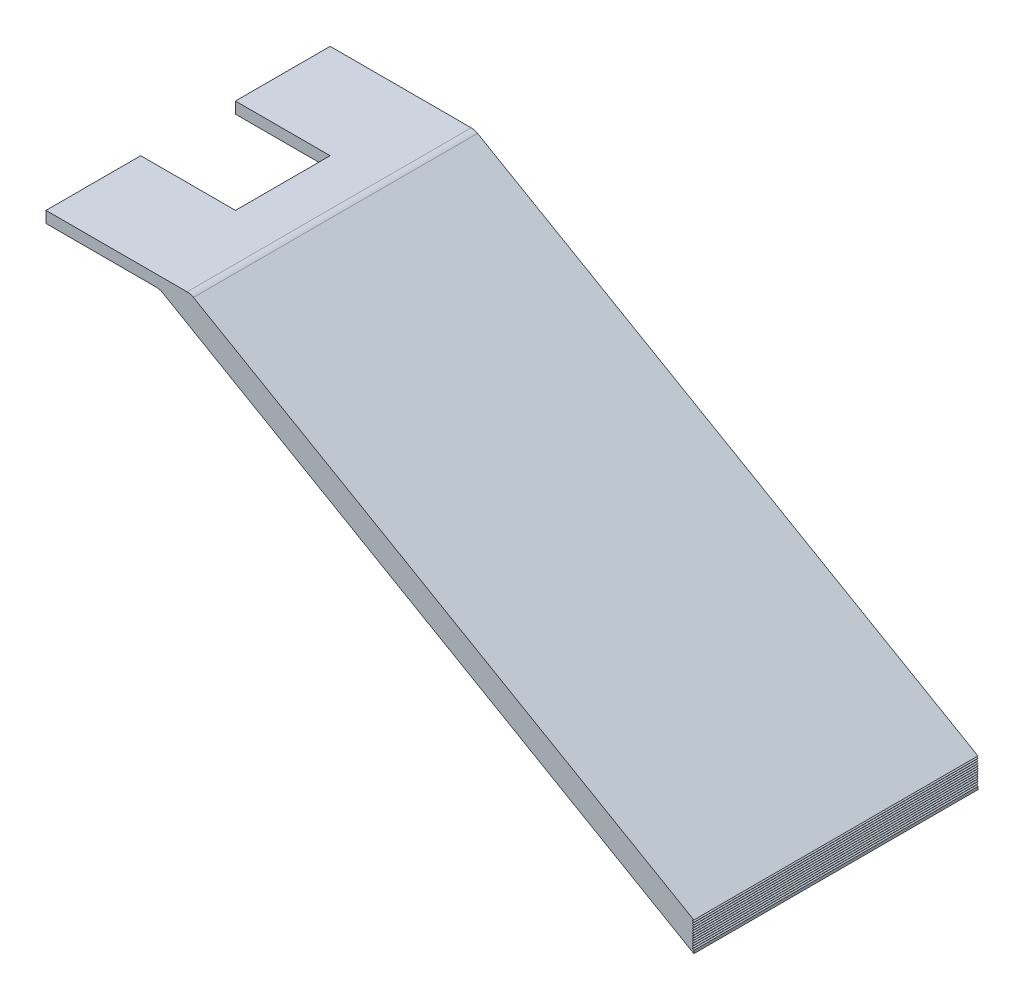
from build123d import *

# Parameters (mm, degrees)
SKETCH_1_W          = 45
SKETCH_1_H          = 1.8
EXTRUDE_1_DEPTH     = 18
SKETCH_2_W          = 15
SKETCH_2_H          = 15
CUT_EXTRUDE_1_DEPTH = 15
EXTRUDE_2_DEPTH     = 45
CUT_EXTRUDE_2_DEPTH = 45
CUT_EXTRUDE_3_DEPTH = 45
FILLET_1_R          = 2
FILLET_2_R          = 2


with BuildPart() as part:
    # 草图1 → 凸台-拉伸1 (new body)
    with BuildSketch(Plane(origin=(0, 0, 0), x_dir=(0, 0, -1), z_dir=(1, 0, 0))):
        Rectangle(SKETCH_1_W, SKETCH_1_H)
    extrude(amount=EXTRUDE_1_DEPTH)

    # 草图2 → 切除-拉伸1 (cut)
    with BuildSketch(Plane(origin=(0, 0.9, 0), x_dir=(1, 0, 0), z_dir=(0, 1, 0))):
        with Locations((7.5, 0)):
            Rectangle(SKETCH_2_W, SKETCH_2_H)
    extrude(amount=-CUT_EXTRUDE_1_DEPTH, mode=Mode.SUBTRACT)

    # 草图4 → 凸台-拉伸2 (add)
    with BuildSketch(Plane(origin=(0, 0, -22.5), x_dir=(-1, 0, 0), z_dir=(0, 0, -1))):
        Polygon((-18, -0.9), (-102.602540378, -49.745299462), (-104.602540378, -46.281197846), (-22.882308546, 0.9), (-18, 0.9), align=None)
    extrude(amount=-EXTRUDE_2_DEPTH)

    # 草图5 → 切除-拉伸2 (cut)
    with BuildSketch(Plane.XY.offset(22.5)):
        Polygon((102.602540378, -45.126497308), (102.602540378, -49.745299462), (104.602540378, -46.281197846), align=None)
    extrude(amount=-CUT_EXTRUDE_2_DEPTH, mode=Mode.SUBTRACT)

    # 草图6 → 切除-拉伸3 (cut)
    with BuildSketch(Plane.XY.offset(22.5)):
        Polygon((102.602540378, -45.126497308), (102.349506488, -45.287661356), (102.602540378, -45.448825404), align=None)
        Polygon((102.602540378, -45.476497308), (102.349506488, -45.637661356), (102.602540378, -45.798825404), align=None)
        Polygon((102.602540378, -45.826497308), (102.349506488, -45.987661356), (102.602540378, -46.148825404), align=None)
        Polygon((102.602540378, -46.176497308), (102.349506488, -46.337661356), (102.602540378, -46.498825404), align=None)
        Polygon((102.602540378, -46.526497308), (102.349506488, -46.687661356), (102.602540378, -46.848825404), align=None)
        Polygon((102.602540378, -46.876497308), (102.349506488, -47.037661356), (102.602540378, -47.198825404), align=None)
        Polygon((102.602540378, -47.226497308), (102.349506488, -47.387661356), (102.602540378, -47.548825404), align=None)
        Polygon((102.602540378, -47.576497308), (102.349506488, -47.737661356), (102.602540378, -47.898825404), align=None)
        Polygon((102.602540378, -47.926497308), (102.349506488, -48.087661356), (102.602540378, -48.248825404), align=None)
        Polygon((102.602540378, -48.276497308), (102.349506488, -48.437661356), (102.602540378, -48.598825404), align=None)
        Polygon((102.602540378, -48.626497308), (102.349506488, -48.787661356), (102.602540378, -48.948825404), align=None)
        Polygon((102.602540378, -48.976497308), (102.349506488, -49.137661356), (102.602540378, -49.298825404), align=None)
    extrude(amount=-CUT_EXTRUDE_3_DEPTH, mode=Mode.SUBTRACT)

    # 圆角1
    fillet_1_edges = [part.edges().sort_by_distance(p)[0] for p in [
        (22.882308546, 0.9, 0),
    ]]
    fillet(fillet_1_edges, radius=FILLET_1_R)

    # 圆角2
    fillet_2_edges = [part.edges().sort_by_distance(p)[0] for p in [
        (18, -0.9, 0),
    ]]
    fillet(fillet_2_edges, radius=FILLET_2_R)


solid = part.part
